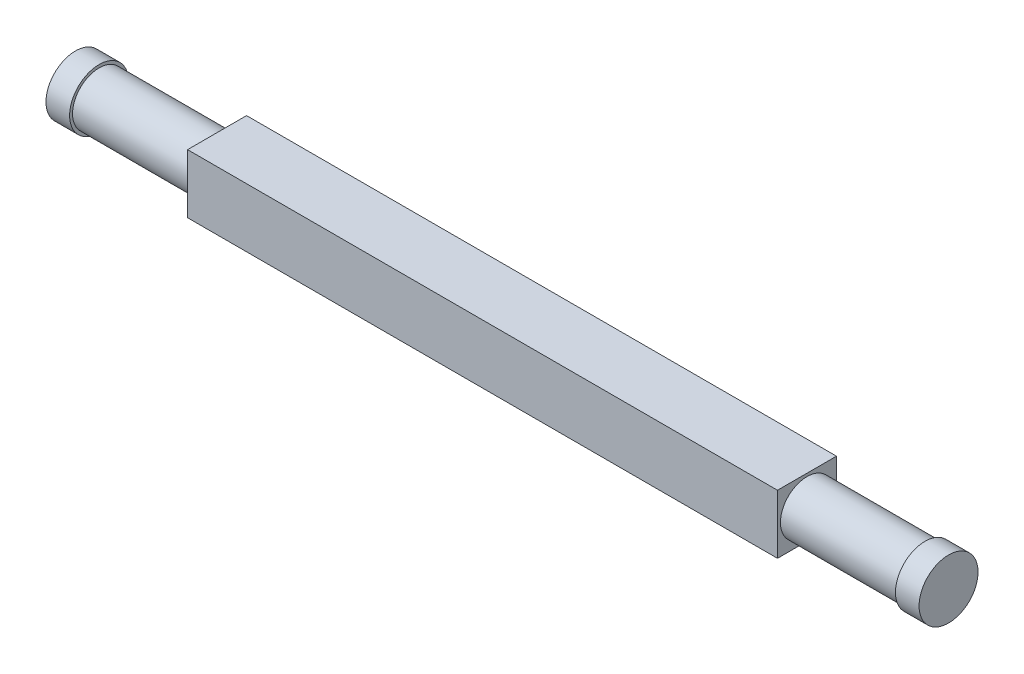
from build123d import *

# Parameters (mm, degrees)
ESBO_O1_W                = 50
ESBO_O1_H                = 5
RESSALTO_EXTRUS_O1_DEPTH = 5
ESBO_O2_R                = 2.25
RESSALTO_EXTRUS_O2_DEPTH = 10
ESBO_O3_R                = 2.5
RESSALTO_EXTRUS_O3_DEPTH = 2


with BuildPart() as part:
    # Esboço1 → Ressalto-extrusão1 (new body)
    with BuildSketch(Plane.XY):
        with Locations((-25, -2.5)):
            Rectangle(ESBO_O1_W, ESBO_O1_H)
    extrude(amount=RESSALTO_EXTRUS_O1_DEPTH)

    # Esboço2 → Ressalto-extrusão2 (add)
    with BuildSketch(Plane.ZY.offset(50)):
        with Locations(Location((2.5, -2.5, 0), (0, 0, 180))):
            Circle(ESBO_O2_R)
    ressalto_extrus_o2 = extrude(amount=RESSALTO_EXTRUS_O2_DEPTH)

    # Esboço3 → Ressalto-extrusão3 (add)
    with BuildSketch(Plane.ZY.offset(60)):
        with Locations((2.5, -2.5)):
            Circle(ESBO_O3_R)
    ressalto_extrus_o3 = extrude(amount=RESSALTO_EXTRUS_O3_DEPTH)

    # Espelhar1: Ressalto-extrusão2, Ressalto-extrusão3 across plane
    add(ressalto_extrus_o2.mirror(Plane.ZY.offset(25)))
    add(ressalto_extrus_o3.mirror(Plane.ZY.offset(25)))


solid = part.part
